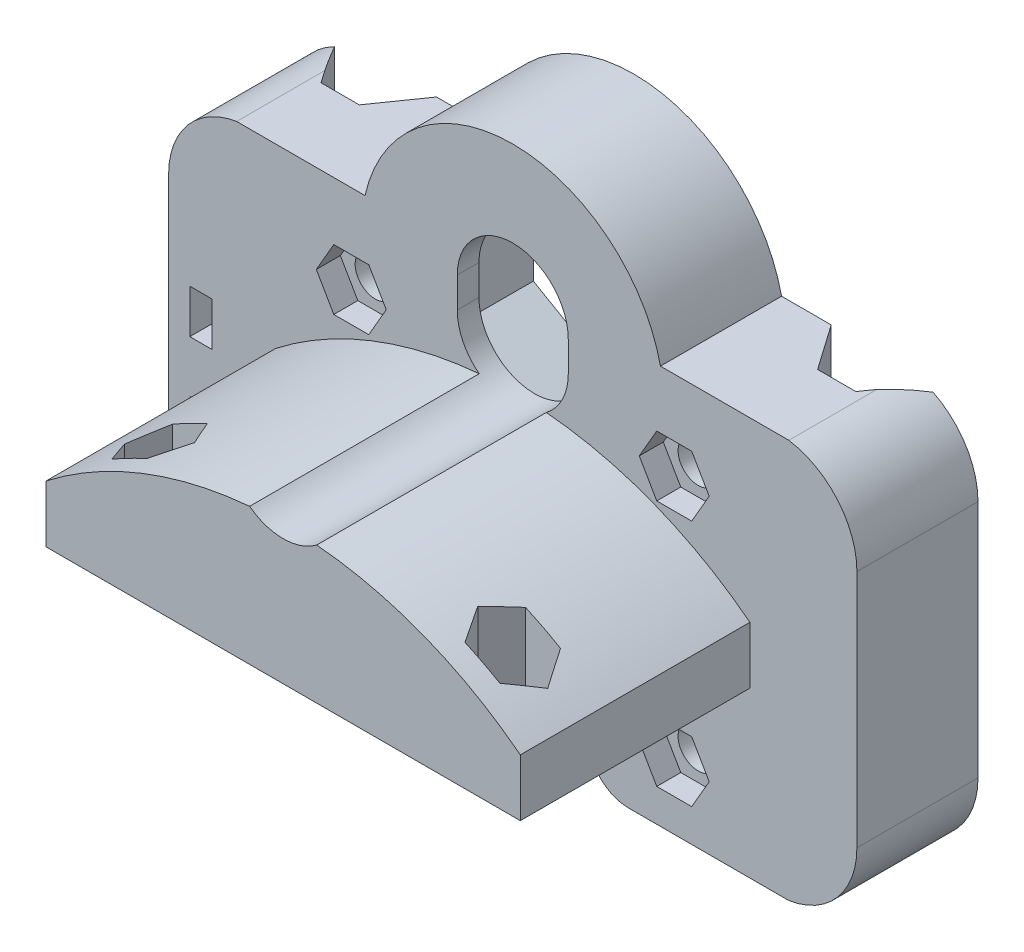
from build123d import *

# Parameters (mm, degrees)
BOSS_EXTRUDE1_DEPTH            = 7.5
BOSS_EXTRUDE1_DEPTH_BACK       = 4.5
SKETCH1_R                      = 2.000043321
SKETCH1_R_2                    = 2.000014119
CUT_EXTRUDE2_DEPTH             = 47.033264554
SKETCH3_R                      = 2.000014119
SKETCH3_R_2                    = 2.000043321
CUT_EXTRUDE3_DEPTH             = 2.38
BOSS_EXTRUDE2_START            = 22.75
SKETCH6_W                      = 23.5
SKETCH6_H                      = 5.65
BOSS_EXTRUDE2_DEPTH            = 22.75
CUT_EXTRUDE5_DEPTH             = 54.759873005
CUT_EXTRUDE5_DEPTH_BACK        = 54.759873005
SKETCH9_R                      = 1.8
CUT_EXTRUDE6_REACH             = 55.76
CUT_EXTRUDE6_END_RADIUS        = 38.27854852
CUT_EXTRUDE6_DIRECTION_2_DEPTH = 4.1004
SKETCH11_R                     = 1.250008473
SKETCH11_R_2                   = 1.24999389
CUT_EXTRUDE8_DEPTH             = 6.1
SKETCH13_W                     = 2.2
SKETCH13_H                     = 4.330124
SKETCH13_H_2                   = 4.33016
CUT_EXTRUDE9_DEPTH             = 5.3
CUT_EXTRUDE10_DEPTH            = 9.85


with BuildPart() as part:
    # Sketch1 → Boss-Extrude1 (new, two sides: drawn at the far end of the back side and taken through both)
    with BuildSketch(Plane.XY.offset(-BOSS_EXTRUDE1_DEPTH_BACK)):
        with BuildLine():
            ThreePointArc((27.3591, -22.750023286), (32.18573506, -20.04264062), (34.100000001, -14.850154064))
            Line((34.100000001, -14.850154064), (34.100000001, 8.850156137))
            ThreePointArc((34.100000001, 8.850156137), (32.18573506, 14.042642693), (27.3591, 16.750025358))
            Line((27.3591, 16.750025358), (14.6356, 16.750025358))
            ThreePointArc((14.6356, 16.750025358), (0, 28.500025358), (-14.6356, 16.750025358))
            Line((-14.6356, 16.750025358), (-27.3591, 16.750025358))
            ThreePointArc((-27.3591, 16.750025358), (-32.18573506, 14.042642693), (-34.100000001, 8.850156137))
            Line((-34.100000001, 8.850156137), (-34.100000001, -14.850154064))
            ThreePointArc((-34.100000001, -14.850154064), (-32.18573506, -20.04264062), (-27.3591, -22.750023286))
            Line((-27.3591, -22.750023286), (-11.500037792, -22.750023286))
            ThreePointArc((-11.500037792, -22.750023286), (-8.671570628, -21.578433826), (-7.499981167, -18.749966661))
            Line((-7.499981167, -18.749966661), (-7.499981167, -16.089239323))
            ThreePointArc((-7.499981167, -16.089239323), (-7.500113179, -16.044739987), (-7.499981167, -16.000240651))
            ThreePointArc((-7.499981167, -16.000240651), (0, -8.544626807), (7.499981167, -16.000240651))
            ThreePointArc((7.499981167, -16.000240651), (7.500113179, -16.044739987), (7.499981167, -16.089239323))
            Line((7.499981167, -16.089239323), (7.499981167, -18.749966661))
            ThreePointArc((7.499981167, -18.749966661), (8.671570628, -21.578433826), (11.500037792, -22.750023286))
            Line((11.500037792, -22.750023286), (27.3591, -22.750023286))
        make_face()
        with Locations((-16.000068831, -16.5)):
            Circle(SKETCH1_R, mode=Mode.SUBTRACT)
        with Locations((16.000068831, -16.5)):
            Circle(SKETCH1_R, mode=Mode.SUBTRACT)
        with Locations((-16.000068831, 7.999981023)):
            Circle(SKETCH1_R_2, mode=Mode.SUBTRACT)
        with Locations((16.000068831, 7.999981023)):
            Circle(SKETCH1_R_2, mode=Mode.SUBTRACT)
    extrude(amount=BOSS_EXTRUDE1_DEPTH + BOSS_EXTRUDE1_DEPTH_BACK)

    # Sketch4 → Cut-Extrude2 (cut, through all)
    with BuildSketch(Plane.XY.offset(7.5)):
        with BuildLine():
            Line((5.5, 11.5), (5.5, 14.5))
            ThreePointArc((5.5, 14.5), (0, 20), (-5.5, 14.5))
            Line((-5.5, 14.5), (-5.5, 11.5))
            ThreePointArc((-5.5, 11.5), (0, 6), (5.5, 11.5))
        make_face()
    extrude(amount=-CUT_EXTRUDE2_DEPTH, mode=Mode.SUBTRACT)

    # Sketch3 → Cut-Extrude3 (cut)
    # profile 1 of 4: a face of its own
    with BuildSketch(Plane.XY.offset(7.5)):
        Polygon((-14.268018024, 10.999981023), (-17.732119639, 10.999981023), (-19.464170446, 7.999981023), (-17.732119639, 4.999981023), (-14.268018024, 4.999981023), (-12.535967216, 7.999981023), align=None)
        with Locations((-16.000068831, 7.999981023)):
            Circle(SKETCH3_R, mode=Mode.SUBTRACT)
    # profile 2 of 4: a face of its own
    with BuildSketch(Plane.XY.offset(7.5)):
        Polygon((14.268018024, 10.999981023), (17.732119639, 10.999981023), (19.464170446, 7.999981023), (17.732119639, 4.999981023), (14.268018024, 4.999981023), (12.535967216, 7.999981023), align=None)
        with Locations((16.000068831, 7.999981023)):
            Circle(SKETCH3_R, mode=Mode.SUBTRACT)
    # profile 3 of 4: a face of its own
    with BuildSketch(Plane.XY.offset(7.5)):
        Polygon((-14.268018024, -19.500018977), (-17.732119639, -19.500018977), (-19.464170446, -16.500018977), (-17.732119639, -13.500018977), (-14.268018024, -13.500018977), (-12.535967216, -16.500018977), align=None)
        with Locations((-16.000068831, -16.5)):
            Circle(SKETCH3_R_2, mode=Mode.SUBTRACT)
    # profile 4 of 4: a face of its own
    with BuildSketch(Plane.XY.offset(7.5)):
        Polygon((12.535967216, -16.500018977), (14.268018024, -19.500018977), (17.732119639, -19.500018977), (19.464170446, -16.500018977), (17.732119639, -13.500018977), (14.268018024, -13.500018977), align=None)
        with Locations((16.000068831, -16.5)):
            Circle(SKETCH3_R_2, mode=Mode.SUBTRACT)
    extrude(amount=-CUT_EXTRUDE3_DEPTH, mode=Mode.SUBTRACT)

    # Sketch6 → Boss-Extrude2 (add)
    with BuildSketch(Plane.XY.offset(7.5).offset(BOSS_EXTRUDE2_START)):
        with Locations((11.75, -3.625)):
            Rectangle(SKETCH6_W, SKETCH6_H)
        with Locations((-11.75, -3.625)):
            Rectangle(SKETCH6_W, SKETCH6_H)
        with BuildLine():
            Line((0, -0.8), (23.5, -0.8))
            ThreePointArc((23.5, -0.8), (13.984131025, 4.616883926), (3.324005419, 7.118106805))
            ThreePointArc((3.324005419, 7.118106805), (0, 6), (-3.324005419, 7.118106805))
            ThreePointArc((-3.324005419, 7.118106805), (-13.984131025, 4.616883926), (-23.5, -0.8))
            Line((-23.5, -0.8), (0, -0.8))
        make_face()
    extrude(amount=-BOSS_EXTRUDE2_DEPTH)

    # Sketch9 → Cut-Extrude5 (cut, two sides: drawn at the far end of the back side and taken through both)
    with BuildSketch(Plane(origin=(0, 0, 0), x_dir=(1, 0, 0), z_dir=(0, 1, 0)).offset(-CUT_EXTRUDE5_DEPTH_BACK)):
        Polygon((19.555132158, 4.5), (22.70606608, 0), (26.49606608, 0), (29.647000001, 4.5), align=None)
        Polygon((-19.555132158, 4.5), (-29.647000001, 4.5), (-26.49606608, 0), (-22.70606608, 0), align=None)
        with Locations(Location((17.5, -25, 0), (0, 0, 270))):
            Circle(SKETCH9_R)
        with Locations(Location((-17.5, -25, 0), (0, 0, 270))):
            Circle(SKETCH9_R)
    extrude(amount=CUT_EXTRUDE5_DEPTH + CUT_EXTRUDE5_DEPTH_BACK, mode=Mode.SUBTRACT)

    # Cut-Extrude6: up to this cylinder (the profile starts inside it)
    cut_extrude6_end = Plane(origin=(0, -31.015844797, 25), z_dir=(0, 0, -1)) * Cylinder(CUT_EXTRUDE6_END_RADIUS, 189.07709704, mode=Mode.PRIVATE)
    # Sketch9<7> → Cut-Extrude6 (cut, up to the surface)
    with BuildSketch(Plane(origin=(0, 0, 0), x_dir=(1, 0, 0), z_dir=(0, 1, 0)), mode=Mode.PRIVATE) as cut_extrude6_sk1:
        Polygon((-19.232050808, -22), (-20.964101615, -25), (-19.232050808, -28), (-15.767949192, -28), (-14.035898385, -25), (-15.767949192, -22), align=None)
    cut_extrude6_tool1 = extrude(cut_extrude6_sk1.sketch, amount=CUT_EXTRUDE6_REACH, mode=Mode.PRIVATE) & cut_extrude6_end
    add(cut_extrude6_tool1.solids().sort_by_distance((-17.5, 0, 25))[0], mode=Mode.SUBTRACT)
    # Sketch9<7> → Cut-Extrude6 (cut, up to the surface)
    with BuildSketch(Plane(origin=(0, 0, 0), x_dir=(1, 0, 0), z_dir=(0, 1, 0)), mode=Mode.PRIVATE) as cut_extrude6_sk2:
        Polygon((20.964101615, -25), (19.232050808, -28), (15.767949192, -28), (14.035898385, -25), (15.767949192, -22), (19.232050808, -22), align=None)
    cut_extrude6_tool2 = extrude(cut_extrude6_sk2.sketch, amount=CUT_EXTRUDE6_REACH, mode=Mode.PRIVATE) & cut_extrude6_end
    add(cut_extrude6_tool2.solids().sort_by_distance((17.5, 0, 25))[0], mode=Mode.SUBTRACT)

    # Sketch9<7> → Cut-Extrude6 direction 2 (cut)
    with BuildSketch(Plane(origin=(0, 0, 0), x_dir=(1, 0, 0), z_dir=(0, 1, 0))):
        Polygon((-19.232050808, -22), (-20.964101615, -25), (-19.232050808, -28), (-15.767949192, -28), (-14.035898385, -25), (-15.767949192, -22), align=None)
        Polygon((20.964101615, -25), (19.232050808, -28), (15.767949192, -28), (14.035898385, -25), (15.767949192, -22), (19.232050808, -22), align=None)
    extrude(amount=-CUT_EXTRUDE6_DIRECTION_2_DEPTH, mode=Mode.SUBTRACT)

    # Sketch11 → Cut-Extrude8 (cut)
    with BuildSketch(Plane.ZY.offset(34.100000001)):
        with Locations((3.549979666, -1.86999177)):
            Circle(SKETCH11_R)
        with Locations((3.549979666, -11.329991983)):
            Circle(SKETCH11_R_2)
    extrude(amount=-CUT_EXTRUDE8_DEPTH, mode=Mode.SUBTRACT)

    # Sketch13 → Cut-Extrude9 (cut)
    with BuildSketch(Plane.XY.offset(7.5)):
        with Locations((-30.9, -1.869998)):
            Rectangle(SKETCH13_W, SKETCH13_H)
        with Locations((-30.9, -11.33002)):
            Rectangle(SKETCH13_W, SKETCH13_H_2)
    extrude(amount=-CUT_EXTRUDE9_DEPTH, mode=Mode.SUBTRACT)

    # Sketch15 → Cut-Extrude10 (cut)
    with BuildSketch(Plane(origin=(0, 0, -4.5), x_dir=(-1, 0, 0), z_dir=(0, 0, -1))):
        Polygon((-7.2e-08, 26), (-9.95929, 20.25), (-9.95929, 5.75), (7.2e-08, 1.24e-07), (9.95929, 5.75), (9.95929, 20.25), align=None)
    extrude(amount=-CUT_EXTRUDE10_DEPTH, mode=Mode.SUBTRACT)


solid = part.part
